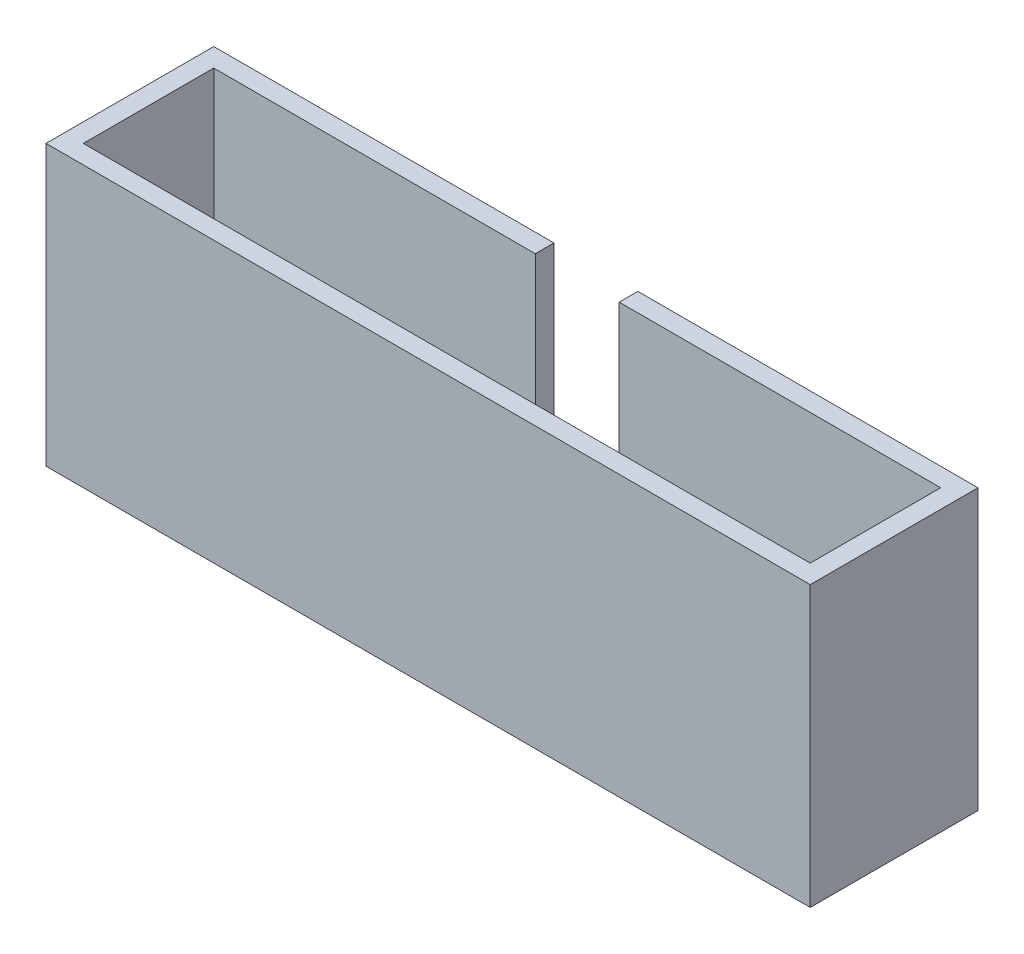
from build123d import *

# Parameters (mm, degrees)
SKETCH_486_W        = 4.5
SKETCH_486_H        = 9
SKETCH_486_W_2      = 41
EXTRUDE_840_DEPTH   = 15
CUT_EXTRUDE_START   = 15
SKETCH_4_W          = 39
SKETCH_4_H          = 7
CUT_EXTRUDE_8_DEPTH = 10
SKETCH_5_W          = 4.5
SKETCH_5_H          = 6.901015062
CUT_EXTRUDE_9_DEPTH = 10


with BuildPart() as part:
    # Sketch 486 → Extrude 840 (new body)
    with BuildSketch(Plane(origin=(0, 0, 0), x_dir=(1, 0, 0), z_dir=(0, 1, 0))):
        Rectangle(SKETCH_486_W, SKETCH_486_H)
        Rectangle(SKETCH_486_W_2, SKETCH_486_H)
    extrude(amount=EXTRUDE_840_DEPTH)

    # 草图4 → 切除-拉伸8 (cut)
    with BuildSketch(Plane(origin=(0, 0, 0), x_dir=(1, 0, 0), z_dir=(0, 1, 0)).offset(CUT_EXTRUDE_START)):
        Rectangle(SKETCH_4_W, SKETCH_4_H)
    extrude(amount=-CUT_EXTRUDE_8_DEPTH, mode=Mode.SUBTRACT)

    # 草图5 → 切除-拉伸9 (cut)
    with BuildSketch(Plane(origin=(0, 15, 0), x_dir=(1, 0, 0), z_dir=(0, 1, 0))):
        with Locations((0, 3.450507531)):
            Rectangle(SKETCH_5_W, SKETCH_5_H)
    extrude(amount=-CUT_EXTRUDE_9_DEPTH, mode=Mode.SUBTRACT)


solid = part.part
